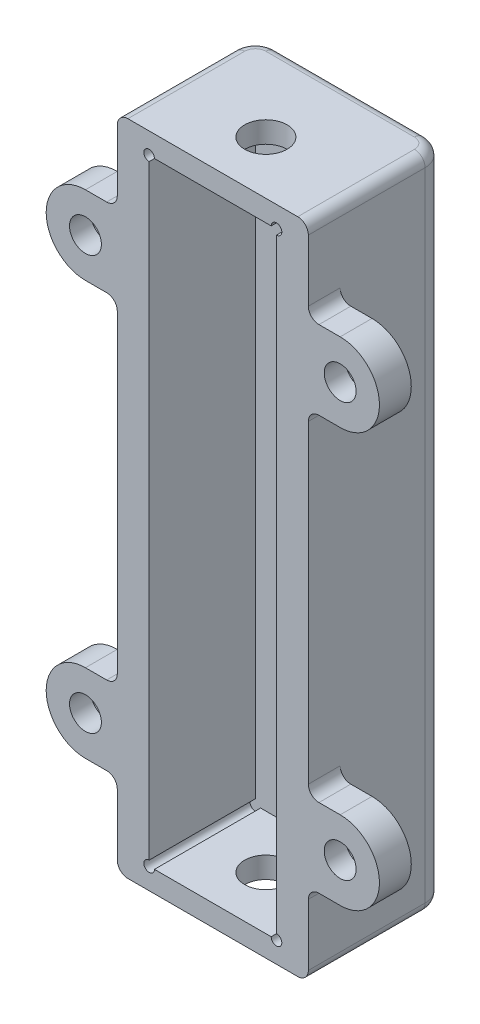
from build123d import *

# Parameters (mm, degrees)
RESSALTO_EXTRUS_O1_DEPTH  = 2
ESBO_O2_R                 = 2
CORTE_EXTRUS_O1_DEPTH     = 2
RESSALTO_EXTRUS_O2_START  = -62
RESSALTO_EXTRUS_O2_DEPTH  = 62
ESBO_O4_R                 = 1.5
RESSALTO_EXTRUS_O4_DEPTH  = 3
FILETE2_R                 = 1
FILETE3_R                 = 1
ESBO_O6_R                 = 1.9
CORTE_EXTRUS_O2_DEPTH     = 1
ESPELHAR3_COPY_1_SKETCH_R = 1.5
ESPELHAR3_COPY_1_DEPTH    = 3
ESPELHAR3_COPY_2_SKETCH_R = 1.9
ESPELHAR3_COPY_2_DEPTH    = 1
FILETE4_R                 = 1
CORTE_EXTRUS_O3_START     = -10
ESBO_O7_W                 = 12
ESBO_O7_H                 = 58
CORTE_EXTRUS_O3_DEPTH     = 10
ESPELHAR5_START           = -10
ESPELHAR5_COPY_1_SKETCH_W = 12
ESPELHAR5_COPY_1_SKETCH_H = 58
ESPELHAR5_COPY_1_DEPTH    = 10


with BuildPart() as part:
    # Esboço1 → Ressalto-extrusão1 (new body)
    with BuildSketch(Plane(origin=(0, 0, 0), x_dir=(1, 0, 0), z_dir=(0, 1, 0))):
        with BuildLine():
            Line((-30.431045005, -40.729157749), (-30.431045005, -41.229157749))
            Line((-30.431045005, -41.229157749), (-29.931045005, -41.229157749))
            Line((-29.931045005, -41.229157749), (-18.931045005, -41.229157749))
            Line((-18.931045005, -41.229157749), (-18.431045005, -41.229157749))
            Line((-18.431045005, -41.229157749), (-18.431045005, -40.729157749))
            Line((-18.431045005, -40.729157749), (-18.431045005, -31.729157749))
            Line((-18.431045005, -31.729157749), (-18.431045005, -31.679157749))
            ThreePointArc((-18.431045005, -31.679157749), (-18.562846954, -31.360959697), (-18.881045005, -31.229157749))
            Line((-18.881045005, -31.229157749), (-18.931045005, -31.229157749))
            Line((-18.931045005, -31.229157749), (-29.931045005, -31.229157749))
            Line((-29.931045005, -31.229157749), (-29.981045005, -31.229157749))
            ThreePointArc((-29.981045005, -31.229157749), (-30.299243057, -31.360959697), (-30.431045005, -31.679157749))
            Line((-30.431045005, -31.679157749), (-30.431045005, -31.729157749))
            Line((-30.431045005, -31.729157749), (-30.431045005, -40.729157749))
        make_face()
    ressalto_extrus_o1 = extrude(amount=RESSALTO_EXTRUS_O1_DEPTH)

    # Esboço2 → Corte-extrusão1 (cut)
    with BuildSketch(Plane(origin=(0, 2, 0), x_dir=(1, 0, 0), z_dir=(0, 1, 0))):
        with Locations(Location((-24.431045005, -36.229157749, 0), (0, 0, 270))):
            Circle(ESBO_O2_R)
    corte_extrus_o1 = extrude(amount=-CORTE_EXTRUS_O1_DEPTH, mode=Mode.SUBTRACT)

    # Esboço3 → Ressalto-extrusão2 (add)
    with BuildSketch(Plane(origin=(0, 2, 0), x_dir=(1, 0, 0), z_dir=(0, 1, 0)).offset(RESSALTO_EXTRUS_O2_START)):
        with BuildLine():
            Line((-29.931045005, -31.229157749), (-29.981045005, -31.229157749))
            ThreePointArc((-29.981045005, -31.229157749), (-30.299243057, -31.360959697), (-30.431045005, -31.679157749))
            Line((-30.431045005, -31.679157749), (-30.431045005, -32.172163455))
            Line((-30.431045005, -32.172163455), (-30.431045005, -41.229157749))
            Line((-30.431045005, -41.229157749), (-33.431045005, -41.229157749))
            Line((-33.431045005, -41.229157749), (-33.431045005, -30.229157749))
            ThreePointArc((-33.431045005, -30.229157749), (-32.845258568, -28.814944187), (-31.431045005, -28.229157749))
            Line((-31.431045005, -28.229157749), (-17.431045005, -28.229157749))
            ThreePointArc((-17.431045005, -28.229157749), (-16.016831443, -28.814944187), (-15.431045005, -30.229157749))
            Line((-15.431045005, -30.229157749), (-15.431045005, -41.229157749))
            Line((-15.431045005, -41.229157749), (-18.431045005, -41.229157749))
            Line((-18.431045005, -41.229157749), (-18.431045005, -31.679157749))
            ThreePointArc((-18.431045005, -31.679157749), (-18.562846954, -31.360959697), (-18.881045005, -31.229157749))
            Line((-18.881045005, -31.229157749), (-29.931045005, -31.229157749))
        make_face()
    extrude(amount=RESSALTO_EXTRUS_O2_DEPTH)

    # Esboço4 → Ressalto-extrusão4 (add)
    with BuildSketch(Plane.XY.offset(41.229157749)):
        with BuildLine():
            Line((-33.431045005, -5.8), (-36.431045005, -5.8))
            ThreePointArc((-36.431045005, -5.8), (-40.131045005, -9.5), (-36.431045005, -13.2))
            Line((-36.431045005, -13.2), (-33.431045005, -13.2))
            Line((-33.431045005, -13.2), (-33.431045005, -5.8))
        make_face()
        with Locations((-36.431045005, -9.5)):
            Circle(ESBO_O4_R, mode=Mode.SUBTRACT)
    ressalto_extrus_o4 = extrude(amount=-RESSALTO_EXTRUS_O4_DEPTH)

    # Filete2
    filete2_edges = [part.edges().sort_by_distance(p)[0] for p in [
        (-33.431045005, -5.8, 39.729157749),
        (-33.431045005, -13.2, 39.729157749),
    ]]
    fillet(filete2_edges, radius=FILETE2_R)

    # Espelhar1: Ressalto-extrusão1, Corte-extrusão1 across plane
    add(ressalto_extrus_o1.mirror(Plane.ZX.offset(-29)))
    add(corte_extrus_o1.mirror(Plane.ZX.offset(-29)), mode=Mode.SUBTRACT)

    # Filete3
    filete3_edges = [part.edges().sort_by_distance(p)[0] for p in [
        (-33.431045005, -60, 35.729157749),
        (-32.845258568, -60, 28.814944187),
        (-24.431045005, -60, 28.229157749),
        (-16.016831443, -60, 28.814944187),
        (-15.431045005, -60, 35.729157749),
        (-15.431045005, 2, 35.729157749),
        (-16.016831443, 2, 28.814944187),
        (-24.431045005, 2, 28.229157749),
        (-32.845258568, 2, 28.814944187),
        (-33.431045005, 2, 35.729157749),
    ]]
    fillet(filete3_edges, radius=FILETE3_R)

    # Esboço6 → Corte-extrusão2 (cut)
    with BuildSketch(Plane(origin=(0, 0, 38.229157749), x_dir=(-1, 0, 0), z_dir=(0, 0, -1))):
        with Locations((36.431045005, -9.5)):
            Circle(ESBO_O6_R)
    corte_extrus_o2 = extrude(amount=-CORTE_EXTRUS_O2_DEPTH, mode=Mode.SUBTRACT)

    # Espelhar2: Ressalto-extrusão4, Corte-extrusão2 across plane
    add(ressalto_extrus_o4.mirror(Plane(origin=(-24.431045005, 0, 0), x_dir=(0, 0, 1), z_dir=(1, 0, 0))))
    add(corte_extrus_o2.mirror(Plane(origin=(-24.431045005, 0, 0), x_dir=(0, 0, 1), z_dir=(1, 0, 0))), mode=Mode.SUBTRACT)

    # Espelhar3: Ressalto-extrusão4, Corte-extrusão2 across plane
    add(ressalto_extrus_o4.mirror(Plane.ZX.offset(-29)))
    add(corte_extrus_o2.mirror(Plane.ZX.offset(-29)), mode=Mode.SUBTRACT)

    # Espelhar3 copy 1 sketch → Espelhar3 copy 1 (add)
    with BuildSketch(Plane(origin=(-48.86209001, -58, 41.229157749), x_dir=(-1, 0, 0), z_dir=(0, 0, 1))):
        with BuildLine():
            Line((-33.431045005, -5.8), (-36.431045005, -5.8))
            ThreePointArc((-36.431045005, -5.8), (-40.131045005, -9.5), (-36.431045005, -13.2))
            Line((-36.431045005, -13.2), (-33.431045005, -13.2))
            Line((-33.431045005, -13.2), (-33.431045005, -5.8))
        make_face()
        with Locations((-36.431045005, -9.5)):
            Circle(ESPELHAR3_COPY_1_SKETCH_R, mode=Mode.SUBTRACT)
    extrude(amount=-ESPELHAR3_COPY_1_DEPTH)

    # Espelhar3 copy 2 sketch → Espelhar3 copy 2 (cut)
    with BuildSketch(Plane(origin=(-48.86209001, -58, 38.229157749), x_dir=(1, 0, 0), z_dir=(0, 0, -1))):
        with Locations((36.431045005, -9.5)):
            Circle(ESPELHAR3_COPY_2_SKETCH_R)
    extrude(amount=-ESPELHAR3_COPY_2_DEPTH, mode=Mode.SUBTRACT)

    # Filete4
    filete4_edges = [part.edges().sort_by_distance(p)[0] for p in [
        (-15.431045005, -5.8, 39.729157749),
        (-15.431045005, -13.2, 39.729157749),
        (-15.431045005, -52.2, 39.729157749),
        (-15.431045005, -44.8, 39.729157749),
        (-33.431045005, -52.2, 39.729157749),
        (-33.431045005, -44.8, 39.729157749),
    ]]
    fillet(filete4_edges, radius=FILETE4_R)

    # Esboço7 → Corte-extrusão3 (cut)
    with BuildSketch(Plane.XY.offset(41.229157749).offset(CORTE_EXTRUS_O3_START)):
        with Locations((-24.431045005, -29)):
            Rectangle(ESBO_O7_W, ESBO_O7_H)
        with BuildLine():
            Line((-30.431045005, -0.5), (-30.431045005, 0))
            Line((-30.431045005, 0), (-29.931045005, 0))
            ThreePointArc((-29.931045005, 0), (-30.784598396, 0.353553391), (-30.431045005, -0.5))
        make_face()
    corte_extrus_o3 = extrude(amount=CORTE_EXTRUS_O3_DEPTH, mode=Mode.SUBTRACT)

    # Espelhar4: Corte-extrusão3 across plane
    add(corte_extrus_o3.mirror(Plane(origin=(-24.431045005, 0, 0), x_dir=(0, 0, 1), z_dir=(1, 0, 0))), mode=Mode.SUBTRACT)

    # Espelhar5: Corte-extrusão3 across plane
    add(corte_extrus_o3.mirror(Plane.ZX.offset(-29)), mode=Mode.SUBTRACT)

    # Espelhar5 copy 1 sketch → Espelhar5 copy 1 (cut)
    with BuildSketch(Plane(origin=(-48.86209001, -58, 41.229157749), x_dir=(-1, 0, 0), z_dir=(0, 0, 1)).offset(ESPELHAR5_START)):
        with Locations((-24.431045005, -29)):
            Rectangle(ESPELHAR5_COPY_1_SKETCH_W, ESPELHAR5_COPY_1_SKETCH_H)
        with BuildLine():
            Line((-30.431045005, -0.5), (-30.431045005, 0))
            Line((-30.431045005, 0), (-29.931045005, 0))
            ThreePointArc((-29.931045005, 0), (-30.784598396, 0.353553391), (-30.431045005, -0.5))
        make_face()
    extrude(amount=ESPELHAR5_COPY_1_DEPTH, mode=Mode.SUBTRACT)


solid = part.part
